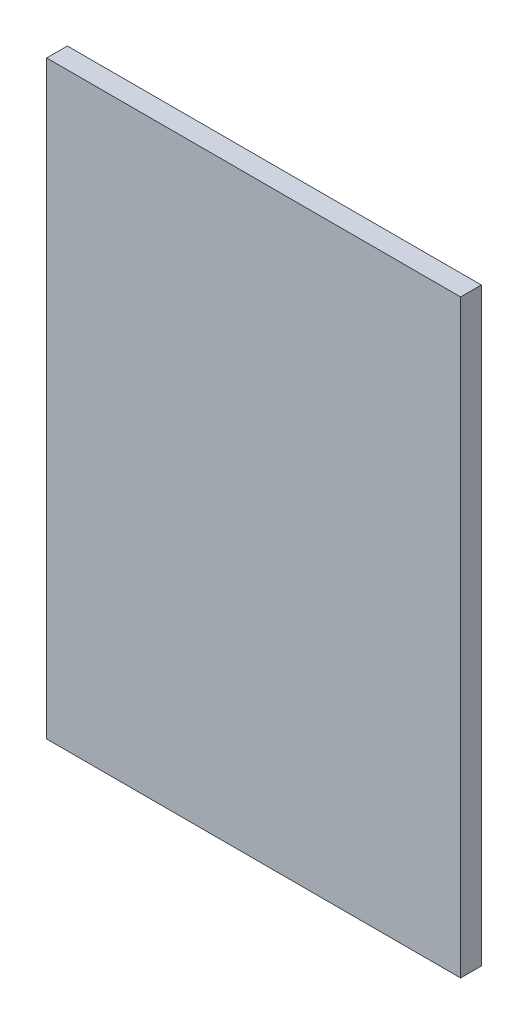
from build123d import *

# Parameters (mm, degrees)
SKETCH1_W           = 254
SKETCH1_H           = 361.95
BOSS_EXTRUDE1_DEPTH = 6.35


with BuildPart() as part:
    # Sketch1 → Boss-Extrude1 (new, symmetric)
    with BuildSketch(Plane.XY):
        Rectangle(SKETCH1_W, SKETCH1_H)
    extrude(amount=BOSS_EXTRUDE1_DEPTH, both=True)


solid = part.part
